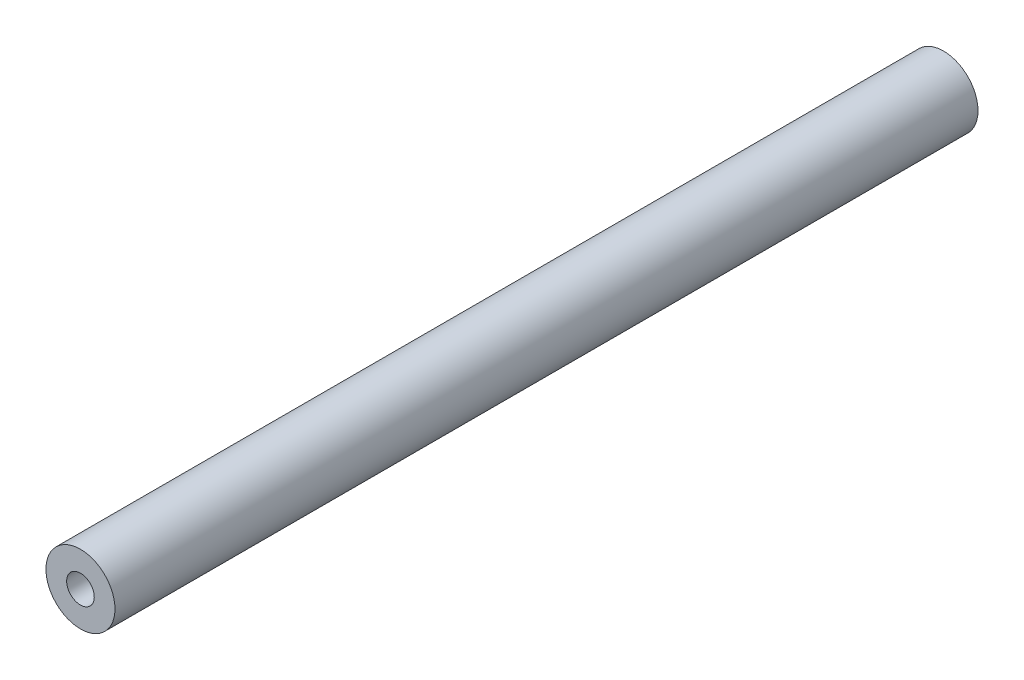
from build123d import *

# Parameters (mm, degrees)
SKETCH_1_R    = 4
SKETCH_1_R_2  = 1.6
F_100MM_DEPTH = 100


with BuildPart() as part:
    # 草图1 → 100mm铝柱 (new body)
    with BuildSketch(Plane.XY):
        Circle(SKETCH_1_R)
        Circle(SKETCH_1_R_2, mode=Mode.SUBTRACT)
    extrude(amount=F_100MM_DEPTH)


solid = part.part
